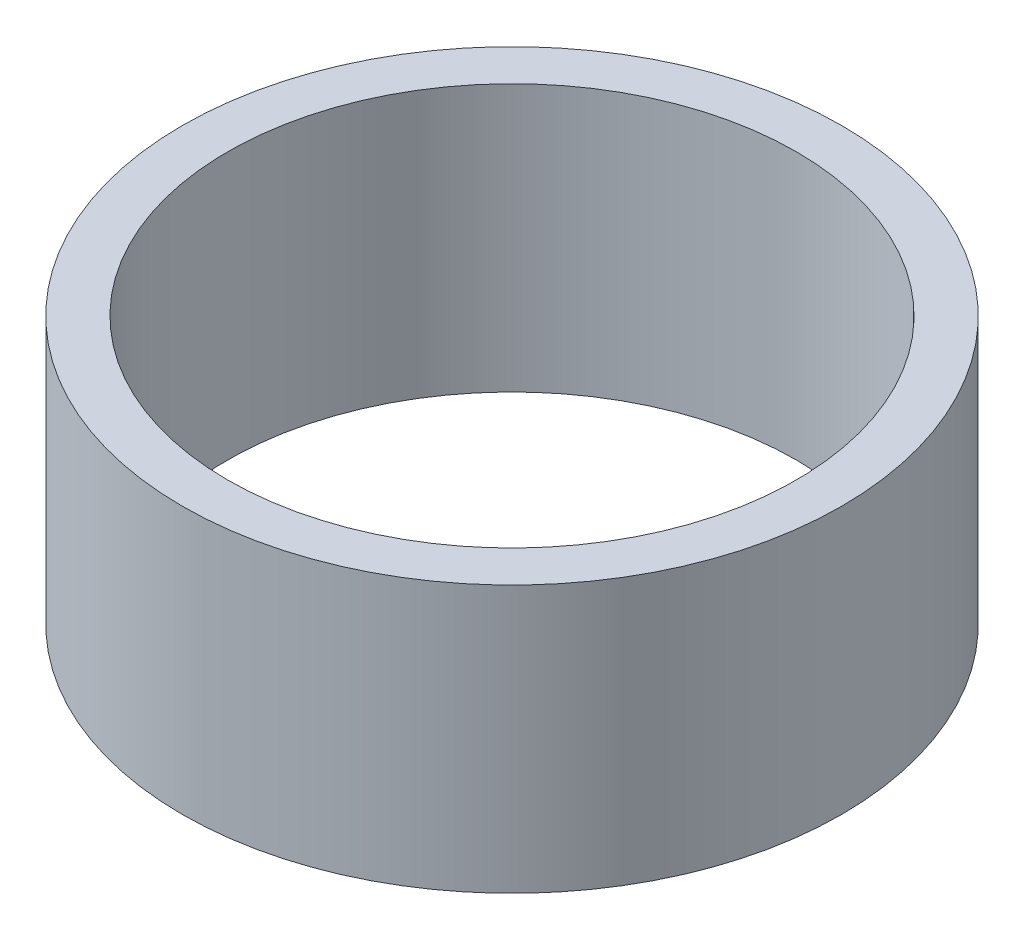
from build123d import *

# Parameters (mm, degrees)
SKETCH1_R           = 12.35
SKETCH1_R_2         = 10.65
BOSS_EXTRUDE1_DEPTH = 10


with BuildPart() as part:
    # Sketch1 → Boss-Extrude1 (new body)
    with BuildSketch(Plane(origin=(0, 0, 0), x_dir=(1, 0, 0), z_dir=(0, 1, 0))):
        with Locations(Location((0, 0, 0), (0, 0, 270))):
            Circle(SKETCH1_R)
        with Locations(Location((0, 0, 0), (0, 0, 270))):
            Circle(SKETCH1_R_2, mode=Mode.SUBTRACT)
    extrude(amount=BOSS_EXTRUDE1_DEPTH)


solid = part.part
